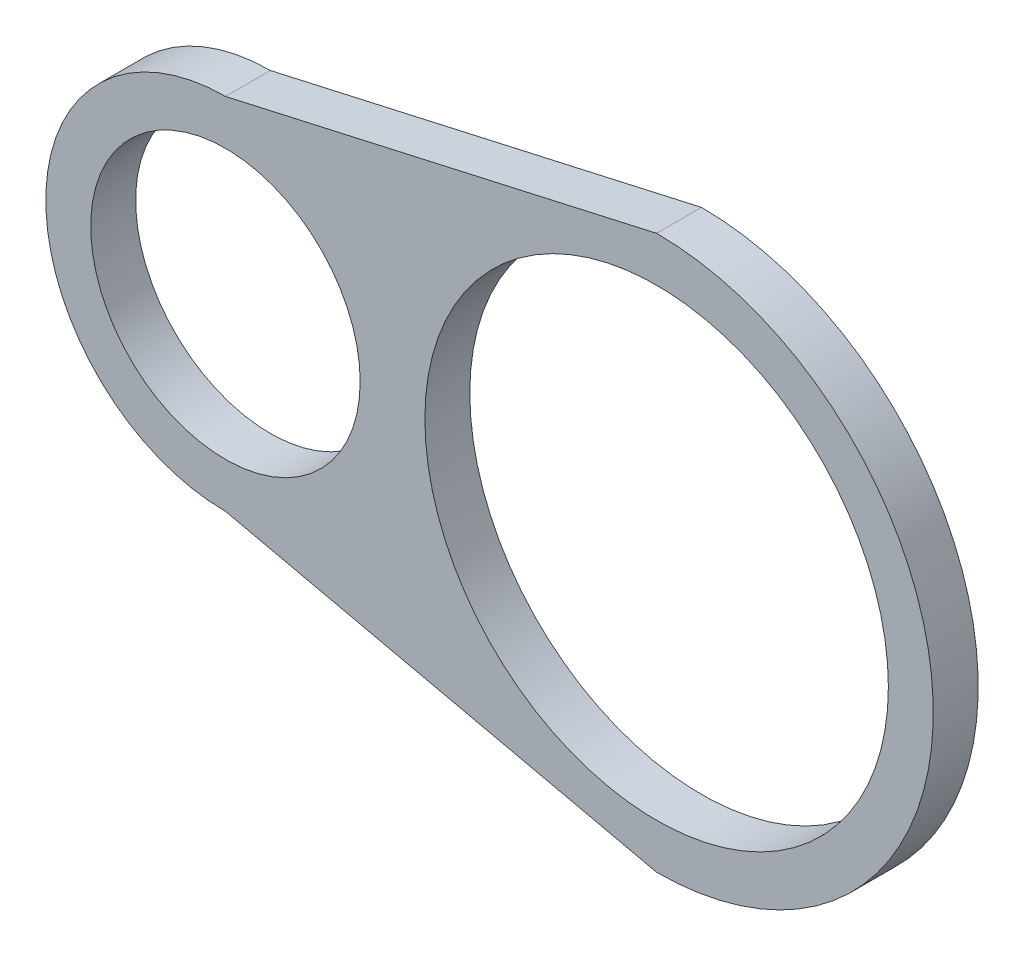
from build123d import *

# Parameters (mm, degrees)
ESBO_O2_R                = 15
ESBO_O2_R_2              = 25.8
RESSALTO_EXTRUS_O1_DEPTH = 5


with BuildPart() as part:
    # Esboço2 → Ressalto-extrusão1 (new body)
    with BuildSketch(Plane.XY):
        with BuildLine():
            Line((24, 30.8), (-24, 20))
            ThreePointArc((-24, 20), (-44, 0), (-24, -20))
            Line((-24, -20), (24, -30.8))
            ThreePointArc((24, -30.8), (54.8, 0), (24, 30.8))
        make_face()
        with Locations((-24, 0)):
            Circle(ESBO_O2_R, mode=Mode.SUBTRACT)
        with Locations((24, 0)):
            Circle(ESBO_O2_R_2, mode=Mode.SUBTRACT)
    extrude(amount=RESSALTO_EXTRUS_O1_DEPTH)


solid = part.part
